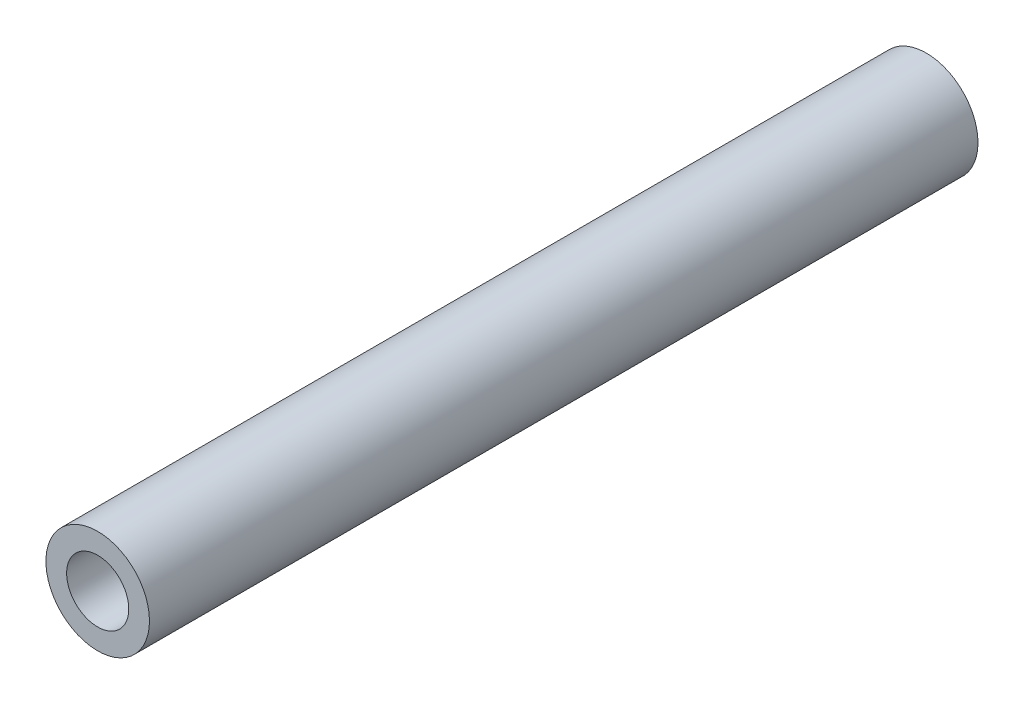
from build123d import *

# Parameters (mm, degrees)
SKETCH_1_R      = 2.5
SKETCH_1_R_2    = 1.5
EXTRUDE_1_DEPTH = 20


with BuildPart() as part:
    # 草图1 → 凸台-拉伸1 (new, symmetric)
    with BuildSketch(Plane.XY):
        Circle(SKETCH_1_R)
        Circle(SKETCH_1_R_2, mode=Mode.SUBTRACT)
    extrude(amount=EXTRUDE_1_DEPTH, both=True)


solid = part.part
